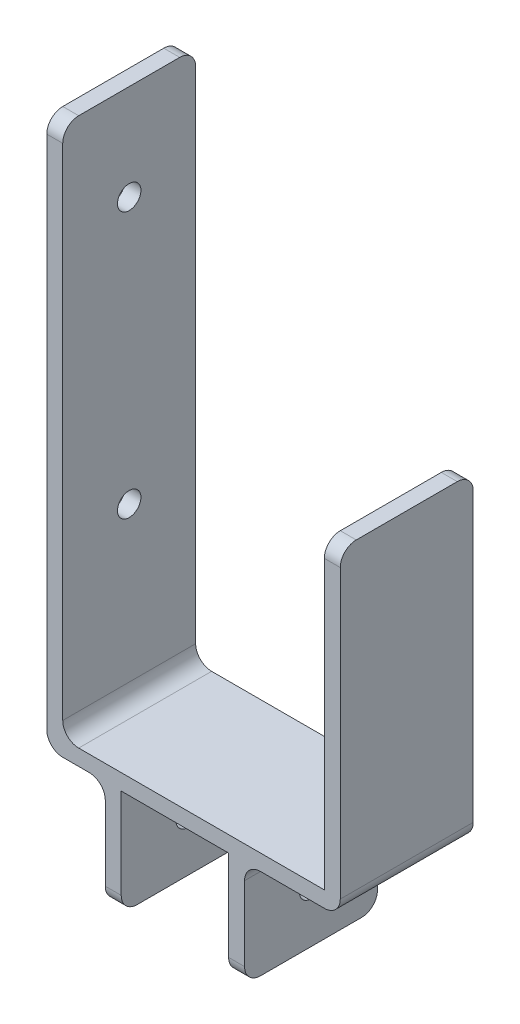
from build123d import *

# Parameters (mm, degrees)
BOSS_EXTRUDE1_DEPTH = 25
FILLET1_R           = 3
SKETCH2_R           = 2.2
CUT_EXTRUDE1_DEPTH  = 40


with BuildPart() as part:
    # Sketch1 → Boss-Extrude1 (new body)
    with BuildSketch(Plane.XY):
        Polygon((-24.6, 0), (24.6, 0), (24.6, 57), (27.6, 57), (27.6, -3), (9.6, -3), (9.6, -23), (6.6, -23), (6.6, -3), (-13.6, -3), (-13.6, -23), (-16.6, -23), (-16.6, -3), (-27.6, -3), (-27.6, 100), (-24.6, 100), align=None)
    extrude(amount=BOSS_EXTRUDE1_DEPTH)

    # Fillet1
    fillet1_edges = [part.edges().sort_by_distance(p)[0] for p in [
        (26.1, 57, 0),
        (8.1, -23, 0),
        (-15.1, -23, 0),
        (-15.1, -23, 25),
        (-26.1, 100, 0),
        (-24.6, 0, 12.5),
        (27.6, -3, 12.5),
        (9.6, -3, 12.5),
        (-16.6, -3, 12.5),
        (-27.6, -3, 12.5),
        (8.1, -23, 25),
        (26.1, 57, 25),
        (-26.1, 100, 25),
    ]]
    fillet(fillet1_edges, radius=FILLET1_R)

    # Sketch2 → Cut-Extrude1 (cut)
    with BuildSketch(Plane.ZY.offset(27.6)):
        with Locations(Location((12.5, 82, 0), (0, 0, 270))):
            Circle(SKETCH2_R)
        with Locations(Location((12.5, 32, 0), (0, 0, 270))):
            Circle(SKETCH2_R)
        with Locations(Location((12.5, -13, 0), (0, 0, 270))):
            Circle(SKETCH2_R)
    extrude(amount=-CUT_EXTRUDE1_DEPTH, mode=Mode.SUBTRACT)


solid = part.part
